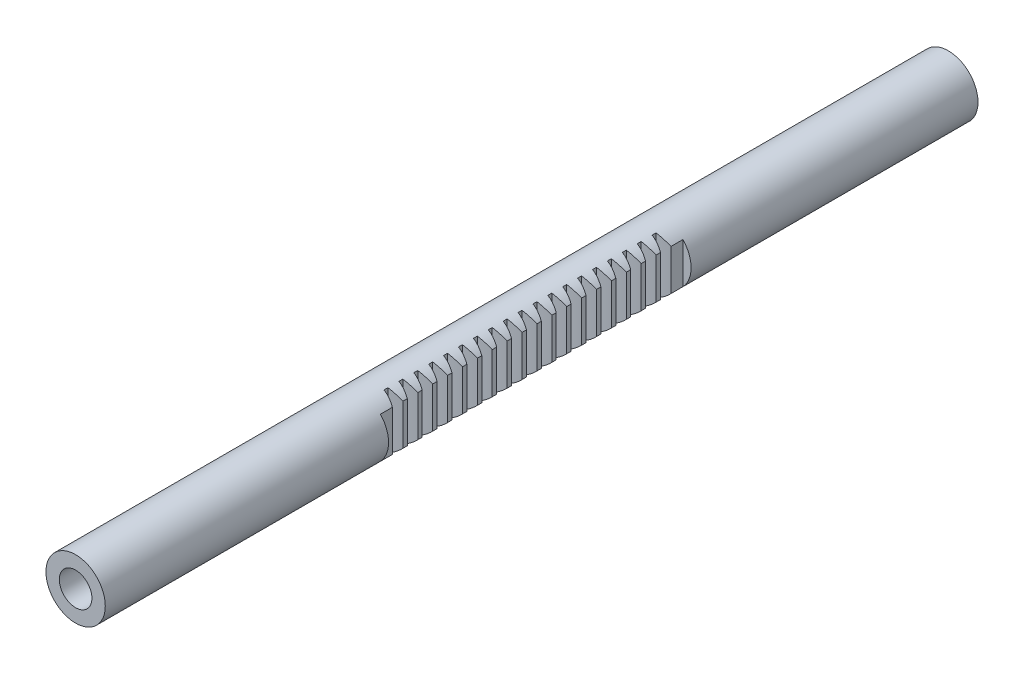
from build123d import *

# Parameters (mm, degrees)
SKETCH1_R               = 12.75
BOSS_EXTRUDE1_DEPTH     = 375
CUT_EXTRUDE1_DEPTH      = 40
CUT_EXTRUDE1_DEPTH_BACK = 45
SKETCH2_W               = 3.5
SKETCH2_H               = 130
CUT_EXTRUDE2_DEPTH      = 45
LPATTERN1_COUNT         = 10
LPATTERN1_PITCH         = 6.4
LPATTERN1_COUNT_DIR2    = 10
LPATTERN1_PITCH_DIR2    = 6.4
SKETCH4_R               = 7
CUT_EXTRUDE3_DEPTH      = 117.5
CUT_EXTRUDE4_START      = -117.5
SKETCH5_R               = 7
CUT_EXTRUDE4_DEPTH      = 117.5


with BuildPart() as part:
    # Sketch1 → Boss-Extrude1 (new body)
    with BuildSketch(Plane.XY):
        Circle(SKETCH1_R)
    extrude(amount=BOSS_EXTRUDE1_DEPTH)

    # Sketch2 → Cut-Extrude1 (cut, two sides: drawn at the far end of the back side and taken through both)
    with BuildSketch(Plane(origin=(0, 0, 0), x_dir=(1, 0, 0), z_dir=(0, 1, 0)).offset(-CUT_EXTRUDE1_DEPTH_BACK)):
        with Locations((11, -188.282678405)):
            Rectangle(SKETCH2_W, SKETCH2_H)
    extrude(amount=CUT_EXTRUDE1_DEPTH + CUT_EXTRUDE1_DEPTH_BACK, mode=Mode.SUBTRACT)

    # Sketch3 → Cut-Extrude2 (cut, symmetric)
    with BuildSketch(Plane(origin=(0, 0, 0), x_dir=(1, 0, 0), z_dir=(0, 1, 0))):
        with BuildLine():
            Line((9.25, -190.525417834), (9.25, -186.025417834))
            ThreePointArc((9.25, -186.025417834), (6.797301158, -186.894350543), (4.25, -187.425417834))
            Line((4.25, -187.425417834), (4.25, -189.125417834))
            ThreePointArc((4.25, -189.125417834), (6.797301158, -189.656485126), (9.25, -190.525417834))
        make_face()
    cut_extrude2 = extrude(amount=CUT_EXTRUDE2_DEPTH, both=True, mode=Mode.SUBTRACT)

    # LPattern1: Cut-Extrude2 10 × 10
    with Locations(*[Vector(0, 0, 1) * (i * LPATTERN1_PITCH) + Vector(0, 0, -1) * (j * LPATTERN1_PITCH_DIR2) for i in range(LPATTERN1_COUNT) for j in range(LPATTERN1_COUNT_DIR2) if (i, j) != (0, 0)]):
        add(cut_extrude2, mode=Mode.SUBTRACT)

    # Sketch4 → Cut-Extrude3 (cut)
    with BuildSketch(Plane(origin=(0, 0, 0), x_dir=(-1, 0, 0), z_dir=(0, 0, -1))):
        Circle(SKETCH4_R)
    extrude(amount=-CUT_EXTRUDE3_DEPTH, mode=Mode.SUBTRACT)

    # Sketch5 → Cut-Extrude4 (cut)
    with BuildSketch(Plane.XY.offset(375).offset(CUT_EXTRUDE4_START)):
        Circle(SKETCH5_R)
    extrude(amount=CUT_EXTRUDE4_DEPTH, mode=Mode.SUBTRACT)


solid = part.part
